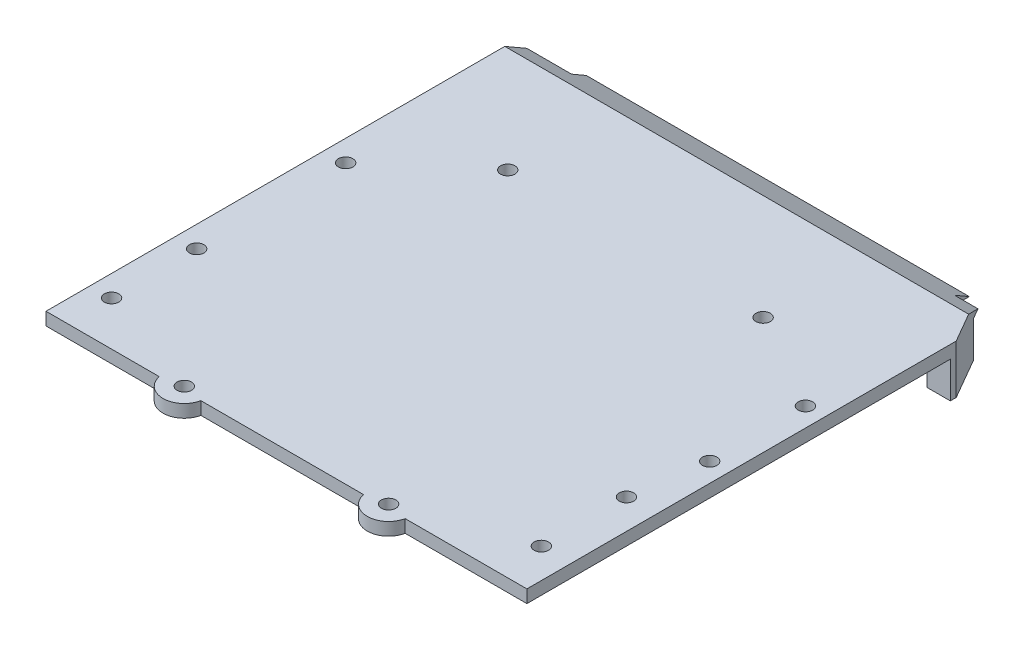
from build123d import *

# Parameters (mm, degrees)
SKETCH_1_W          = 113
SKETCH_1_H          = 113
EXTRUDE_1_DEPTH     = 3
CUT_EXTRUDE_1_REACH = 161.834
SKETCH_2_R          = 1.7
SKETCH_3_W          = 90
SKETCH_3_H          = 105
EXTRUDE_2_DEPTH     = 2
SKETCH_5_R          = 5
EXTRUDE_3_DEPTH     = 3
CUT_EXTRUDE_2_REACH = 161.834
SKETCH_6_R          = 1.7
CUT_EXTRUDE_3_REACH = 161.834
SKETCH_7_R          = 1.7
CUT_EXTRUDE_4_REACH = 161.884
SKETCH_8_R          = 1.7
EXTRUDE_5_DEPTH     = 90
CUT_EXTRUDE_5_DEPTH = 2
SKETCH_13_W         = 2
SKETCH_13_H         = 12
EXTRUDE_6_DEPTH     = 11.5
CUT_EXTRUDE_6_REACH = 162.612
SKETCH_14_R         = 1.7
CUT_EXTRUDE_7_REACH = 164.681
EXTRUDE_7_DEPTH     = 8.5
SKETCH_17_W         = 2
SKETCH_17_H         = 11.5
EXTRUDE_8_DEPTH     = 3
FILLET_1_R          = 1
CUT_EXTRUDE_8_DEPTH = 163.681089759


with BuildPart() as part:
    # 草图1 → 凸台-拉伸1 (new body)
    with BuildSketch(Plane(origin=(0, 0, 0), x_dir=(1, 0, 0), z_dir=(0, 1, 0))):
        with Locations((56.5, 56.5)):
            Rectangle(SKETCH_1_W, SKETCH_1_H)
    extrude(amount=EXTRUDE_1_DEPTH)

    # 草图2 → 切除-拉伸1 (cut, up to next)
    with BuildSketch(Plane(origin=(0, 3, 0), x_dir=(1, 0, 0), z_dir=(0, 1, 0)), mode=Mode.PRIVATE) as cut_extrude_1_sk1:
        with Locations(Location((108.5, 69.95, 0), (0, 0, 270))):
            Circle(SKETCH_2_R)
    cut_extrude_1_tool1 = extrude(cut_extrude_1_sk1.sketch, amount=-CUT_EXTRUDE_1_REACH, mode=Mode.PRIVATE) & part.part
    # 草图2 → 切除-拉伸1 (cut, up to next)
    with BuildSketch(Plane(origin=(0, 3, 0), x_dir=(1, 0, 0), z_dir=(0, 1, 0)), mode=Mode.PRIVATE) as cut_extrude_1_sk2:
        with Locations(Location((108.5, 47.45, 0), (0, 0, 270))):
            Circle(SKETCH_2_R)
    cut_extrude_1_tool2 = extrude(cut_extrude_1_sk2.sketch, amount=-CUT_EXTRUDE_1_REACH, mode=Mode.PRIVATE) & part.part
    # 草图2 → 切除-拉伸1 (cut, up to next)
    with BuildSketch(Plane(origin=(0, 3, 0), x_dir=(1, 0, 0), z_dir=(0, 1, 0)), mode=Mode.PRIVATE) as cut_extrude_1_sk3:
        with Locations(Location((106, 30.4, 0), (0, 0, 270))):
            Circle(SKETCH_2_R)
    cut_extrude_1_tool3 = extrude(cut_extrude_1_sk3.sketch, amount=-CUT_EXTRUDE_1_REACH, mode=Mode.PRIVATE) & part.part
    # 草图2 → 切除-拉伸1 (cut, up to next)
    with BuildSketch(Plane(origin=(0, 3, 0), x_dir=(1, 0, 0), z_dir=(0, 1, 0)), mode=Mode.PRIVATE) as cut_extrude_1_sk4:
        with Locations(Location((106, 10.4, 0), (0, 0, 270))):
            Circle(SKETCH_2_R)
    cut_extrude_1_tool4 = extrude(cut_extrude_1_sk4.sketch, amount=-CUT_EXTRUDE_1_REACH, mode=Mode.PRIVATE) & part.part
    add(cut_extrude_1_tool1.solids().sort_by_distance((108.5, 3, -69.95))[0], mode=Mode.SUBTRACT)
    add(cut_extrude_1_tool2.solids().sort_by_distance((108.5, 3, -47.45))[0], mode=Mode.SUBTRACT)
    add(cut_extrude_1_tool3.solids().sort_by_distance((106, 3, -30.4))[0], mode=Mode.SUBTRACT)
    add(cut_extrude_1_tool4.solids().sort_by_distance((106, 3, -10.4))[0], mode=Mode.SUBTRACT)

    # 草图3 → 凸台-拉伸2 (add)
    with BuildSketch(Plane(origin=(0, 0, 0), x_dir=(1, 0, 0), z_dir=(0, 1, 0))):
        with Locations((55.5, 60.5)):
            Rectangle(SKETCH_3_W, SKETCH_3_H)
    extrude(amount=-EXTRUDE_2_DEPTH)

    # 草图5 → 凸台-拉伸3 (add)
    with BuildSketch(Plane.XZ):
        with Locations((79.5, -1)):
            Circle(SKETCH_5_R)
        with Locations((31.5, -1)):
            Circle(SKETCH_5_R)
    extrude(amount=-EXTRUDE_3_DEPTH)

    # 草图6 → 切除-拉伸2 (cut, up to next)
    with BuildSketch(Plane.XZ, mode=Mode.PRIVATE) as cut_extrude_2_sk1:
        with Locations(Location((31.5, -1, 0), (0, 0, 270))):
            Circle(SKETCH_6_R)
    cut_extrude_2_tool1 = extrude(cut_extrude_2_sk1.sketch, amount=-CUT_EXTRUDE_2_REACH, mode=Mode.PRIVATE) & part.part
    # 草图6 → 切除-拉伸2 (cut, up to next)
    with BuildSketch(Plane.XZ, mode=Mode.PRIVATE) as cut_extrude_2_sk2:
        with Locations(Location((79.5, -1, 0), (0, 0, 270))):
            Circle(SKETCH_6_R)
    cut_extrude_2_tool2 = extrude(cut_extrude_2_sk2.sketch, amount=-CUT_EXTRUDE_2_REACH, mode=Mode.PRIVATE) & part.part
    add(cut_extrude_2_tool1.solids().sort_by_distance((31.5, 0, -1))[0], mode=Mode.SUBTRACT)
    add(cut_extrude_2_tool2.solids().sort_by_distance((79.5, 0, -1))[0], mode=Mode.SUBTRACT)

    # 草图7 → 切除-拉伸3 (cut, up to next)
    with BuildSketch(Plane.XZ, mode=Mode.PRIVATE) as cut_extrude_3_sk1:
        with Locations(Location((5, -10.4, 0), (0, 0, 270))):
            Circle(SKETCH_7_R)
    cut_extrude_3_tool1 = extrude(cut_extrude_3_sk1.sketch, amount=-CUT_EXTRUDE_3_REACH, mode=Mode.PRIVATE) & part.part
    # 草图7 → 切除-拉伸3 (cut, up to next)
    with BuildSketch(Plane.XZ, mode=Mode.PRIVATE) as cut_extrude_3_sk2:
        with Locations(Location((5, -30.4, 0), (0, 0, 270))):
            Circle(SKETCH_7_R)
    cut_extrude_3_tool2 = extrude(cut_extrude_3_sk2.sketch, amount=-CUT_EXTRUDE_3_REACH, mode=Mode.PRIVATE) & part.part
    # 草图7 → 切除-拉伸3 (cut, up to next)
    with BuildSketch(Plane.XZ, mode=Mode.PRIVATE) as cut_extrude_3_sk3:
        with Locations(Location((5, -65.4, 0), (0, 0, 270))):
            Circle(SKETCH_7_R)
    cut_extrude_3_tool3 = extrude(cut_extrude_3_sk3.sketch, amount=-CUT_EXTRUDE_3_REACH, mode=Mode.PRIVATE) & part.part
    add(cut_extrude_3_tool1.solids().sort_by_distance((5, 0, -10.4))[0], mode=Mode.SUBTRACT)
    add(cut_extrude_3_tool2.solids().sort_by_distance((5, 0, -30.4))[0], mode=Mode.SUBTRACT)
    add(cut_extrude_3_tool3.solids().sort_by_distance((5, 0, -65.4))[0], mode=Mode.SUBTRACT)

    # 草图8 → 切除-拉伸4 (cut, up to next)
    with BuildSketch(Plane.XZ.offset(2), mode=Mode.PRIVATE) as cut_extrude_4_sk1:
        with Locations(Location((25.5, -83, 0), (0, 0, 270))):
            Circle(SKETCH_8_R)
    cut_extrude_4_tool1 = extrude(cut_extrude_4_sk1.sketch, amount=-CUT_EXTRUDE_4_REACH, mode=Mode.PRIVATE) & part.part
    # 草图8 → 切除-拉伸4 (cut, up to next)
    with BuildSketch(Plane.XZ.offset(2), mode=Mode.PRIVATE) as cut_extrude_4_sk2:
        with Locations(Location((85.5, -83, 0), (0, 0, 270))):
            Circle(SKETCH_8_R)
    cut_extrude_4_tool2 = extrude(cut_extrude_4_sk2.sketch, amount=-CUT_EXTRUDE_4_REACH, mode=Mode.PRIVATE) & part.part
    add(cut_extrude_4_tool1.solids().sort_by_distance((25.5, -2, -83))[0], mode=Mode.SUBTRACT)
    add(cut_extrude_4_tool2.solids().sort_by_distance((85.5, -2, -83))[0], mode=Mode.SUBTRACT)

    # 草图10 → 凸台-拉伸5 (add)
    with BuildSketch(Plane(origin=(100.5, 0, 0), x_dir=(0, 0, -1), z_dir=(1, 0, 0))):
        Polygon((113, 0), (116.464101615, -2), (113, -2), align=None)
    extrude(amount=-EXTRUDE_5_DEPTH)

    # 草图11 → 切除-拉伸5 (cut)
    with BuildSketch(Plane(origin=(0, -2, 0), x_dir=(1, 0, 0), z_dir=(0, 1, 0))):
        with BuildLine():
            Line((20.5, 83), (20.5, 23))
            ThreePointArc((20.5, 23), (25.5, 18), (30.5, 23))
            Line((30.5, 23), (30.5, 83))
            ThreePointArc((30.5, 83), (25.5, 88), (20.5, 83))
        make_face()
        with BuildLine():
            Line((80.5, 83), (80.5, 23))
            ThreePointArc((80.5, 23), (85.5, 18), (90.5, 23))
            Line((90.5, 23), (90.5, 83))
            ThreePointArc((90.5, 83), (85.5, 88), (80.5, 83))
        make_face()
    extrude(amount=CUT_EXTRUDE_5_DEPTH, mode=Mode.SUBTRACT)

    # 草图13 → 凸台-拉伸6 (add)
    with BuildSketch(Plane.XZ):
        with Locations((4, -83)):
            Rectangle(SKETCH_13_W, SKETCH_13_H)
    extrude(amount=EXTRUDE_6_DEPTH)

    # 草图14 → 切除-拉伸6 (cut, up to next)
    with BuildSketch(Plane.ZY.offset(-3), mode=Mode.PRIVATE) as cut_extrude_6_sk1:
        with Locations((-83.5, -5)):
            Circle(SKETCH_14_R)
    cut_extrude_6_tool1 = extrude(cut_extrude_6_sk1.sketch, amount=-CUT_EXTRUDE_6_REACH, mode=Mode.PRIVATE) & part.part
    add(cut_extrude_6_tool1.solids().sort_by_distance((3, -5, -83.5))[0], mode=Mode.SUBTRACT)

    # 草图15 → 切除-拉伸7 (cut, up to next)
    with BuildSketch(Plane.XZ, mode=Mode.PRIVATE) as cut_extrude_7_sk1:
        Polygon((113, -100.875644347), (106, -113), (113, -113), align=None)
    cut_extrude_7_tool1 = extrude(cut_extrude_7_sk1.sketch, amount=-CUT_EXTRUDE_7_REACH, mode=Mode.PRIVATE) & part.part
    add(cut_extrude_7_tool1.solids().sort_by_distance((110.666667, 0, -108.958548))[0], mode=Mode.SUBTRACT)

    # 草图16 → 凸台-拉伸7 (add)
    with BuildSketch(Plane.XZ):
        Polygon((113, -99.5), (107.5, -99.5), (107.5, -110.401923789), (113, -100.875644347), align=None)
    extrude(amount=EXTRUDE_7_DEPTH)

    # 草图17 → 凸台-拉伸8 (add)
    with BuildSketch(Plane.ZY.offset(-3)):
        with Locations((-78, -5.75)):
            Rectangle(SKETCH_17_W, SKETCH_17_H)
    extrude(amount=EXTRUDE_8_DEPTH)

    # 圆角1
    fillet_1_edges = [part.edges().sort_by_distance(p)[0] for p in [
        (3, -5.75, -79),
    ]]
    fillet(fillet_1_edges, radius=FILLET_1_R)

    # 草图19 → 切除-拉伸8 (cut, through all)
    with BuildSketch(Plane.ZY):
        Polygon((-113, 0), (-107.803847577, 3), (-113, 3), align=None)
    extrude(amount=-CUT_EXTRUDE_8_DEPTH, mode=Mode.SUBTRACT)


solid = part.part
